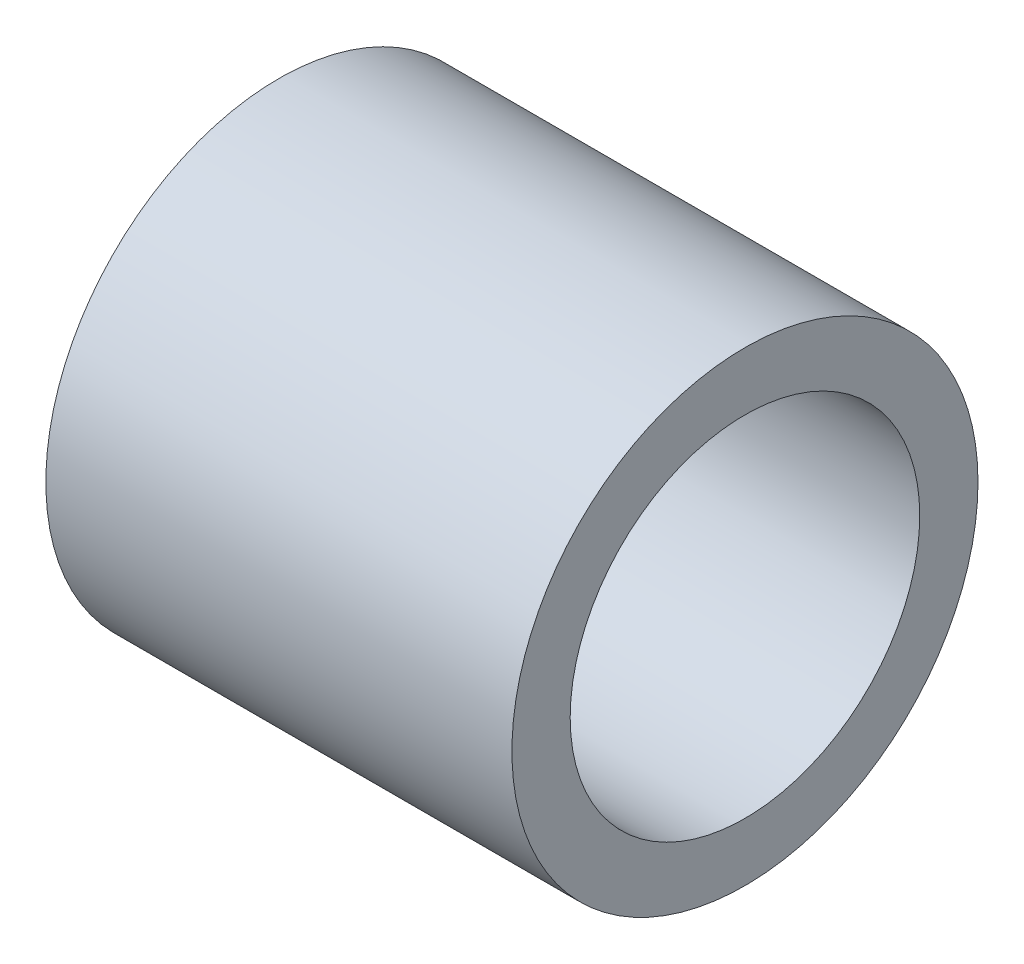
from build123d import *

# Parameters (mm, degrees)
SKETCH1_R           = 12.7
SKETCH1_R_2         = 9.525
BOSS_EXTRUDE1_DEPTH = 12.7


with BuildPart() as part:
    # Sketch1 → Boss-Extrude1 (new, symmetric)
    with BuildSketch(Plane(origin=(0, 0, 0), x_dir=(0, 0, -1), z_dir=(1, 0, 0))):
        Circle(SKETCH1_R)
        Circle(SKETCH1_R_2, mode=Mode.SUBTRACT)
    extrude(amount=BOSS_EXTRUDE1_DEPTH, both=True)


solid = part.part
